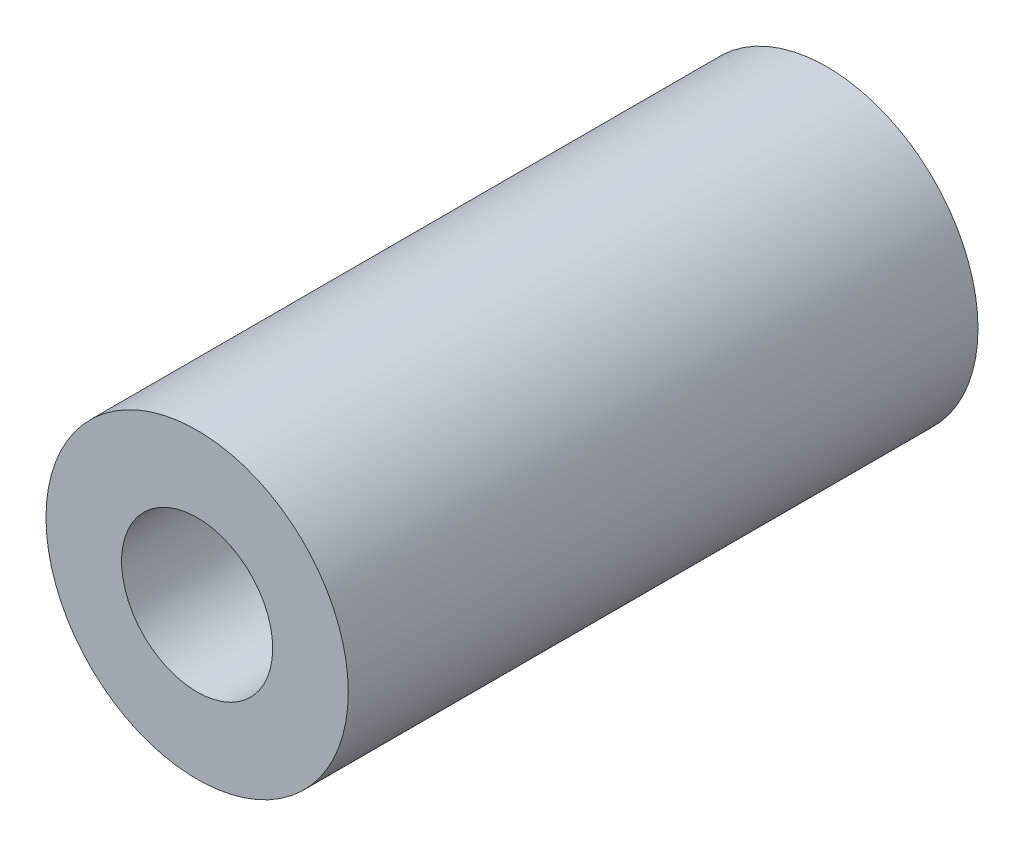
from build123d import *

# Parameters (mm, degrees)
SKETCH1_R           = 6
SKETCH1_R_2         = 3
BOSS_EXTRUDE2_DEPTH = 25


with BuildPart() as part:
    # Sketch1 → Boss-Extrude2 (new body)
    with BuildSketch(Plane.XY):
        Circle(SKETCH1_R)
        Circle(SKETCH1_R_2, mode=Mode.SUBTRACT)
    extrude(amount=BOSS_EXTRUDE2_DEPTH)


solid = part.part
